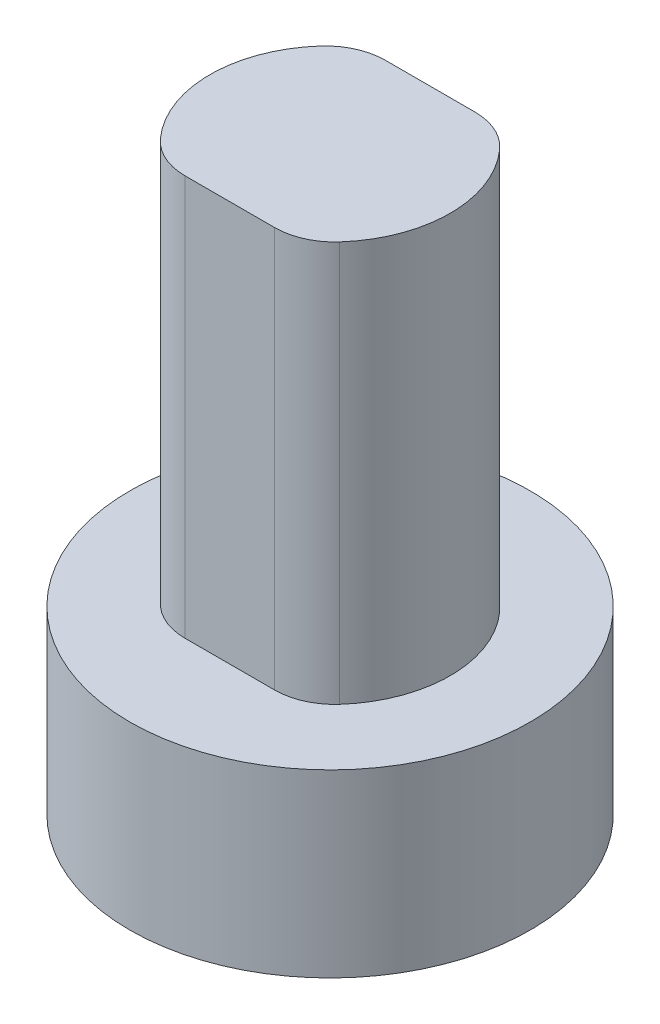
from build123d import *

# Parameters (mm, degrees)
SKETCH1_R              = 10
SKETCH1_R_2            = 2.5
BOSS_EXTRUDE1_DEPTH    = 9
BOSS_EXTRUDE2_DEPTH    = 20
SKETCH5_R              = 2.5
CUT_EXTRUDE3_DEPTH     = 13
FILLET1_R              = 3
M4_TAPPED_HOLE1_REACH  = 35.17
M4_TAPPED_HOLE1_BORE_R = 1.65
CIRPATTERN1_COUNT      = 2
CIRPATTERN1_ANGLE      = 120


with BuildPart() as part:
    # Sketch1 → Boss-Extrude1 (new body)
    with BuildSketch(Plane(origin=(0, 0, 0), x_dir=(1, 0, 0), z_dir=(0, 1, 0))):
        with Locations(Location((0, 0, 0), (0, 0, 270))):
            Circle(SKETCH1_R)
        with Locations(Location((0, 0, 0), (0, 0, 270))):
            Circle(SKETCH1_R_2, mode=Mode.SUBTRACT)
    extrude(amount=BOSS_EXTRUDE1_DEPTH)

    # Sketch4 → Boss-Extrude2 (add)
    with BuildSketch(Plane(origin=(0, 9, 0), x_dir=(1, 0, 0), z_dir=(0, 1, 0))):
        with BuildLine():
            Line((-3.31662479, -5), (3.31662479, -5))
            ThreePointArc((3.31662479, -5), (6, 0), (3.31662479, 5))
            Line((3.31662479, 5), (-3.31662479, 5))
            ThreePointArc((-3.31662479, 5), (-6, 0), (-3.31662479, -5))
        make_face()
    extrude(amount=BOSS_EXTRUDE2_DEPTH)

    # Sketch5 → Cut-Extrude3 (cut)
    with BuildSketch(Plane.XZ.offset(-9)):
        with Locations(Location((0, 0, 0), (0, 0, 270))):
            Circle(SKETCH5_R)
    extrude(amount=-CUT_EXTRUDE3_DEPTH, mode=Mode.SUBTRACT)

    # Fillet1
    fillet1_edges = [part.edges().sort_by_distance(p)[0] for p in [
        (3.31662479, 19, 5),
        (3.31662479, 19, -5),
        (-3.31662479, 19, -5),
        (-3.31662479, 19, 5),
    ]]
    fillet(fillet1_edges, radius=FILLET1_R)

    # M4 Tapped Hole1 bore (on position points) → M4 Tapped Hole1 (cut, up to next)
    with BuildSketch(Plane(origin=(0, 4.5, -10), x_dir=(-1, 0, 0), z_dir=(0, 0, -1)), mode=Mode.PRIVATE) as m4_tapped_hole1_sk1:
        Circle(M4_TAPPED_HOLE1_BORE_R)
    m4_tapped_hole1_tool1 = extrude(m4_tapped_hole1_sk1.sketch, amount=-M4_TAPPED_HOLE1_REACH, mode=Mode.PRIVATE) & part.part
    m4_tapped_hole1 = m4_tapped_hole1_tool1.solids().sort_by_distance((0, 4.5, -10))[0]
    add(m4_tapped_hole1, mode=Mode.SUBTRACT)

    # CirPattern1: M4 Tapped Hole1 ×2 about axis
    cirpattern1_axis = Axis((0, 9, 0), (0, 1, 0))
    for i in range(1, CIRPATTERN1_COUNT):
        add(m4_tapped_hole1.rotate(cirpattern1_axis, i * CIRPATTERN1_ANGLE / (CIRPATTERN1_COUNT - 1)), mode=Mode.SUBTRACT)


solid = part.part
